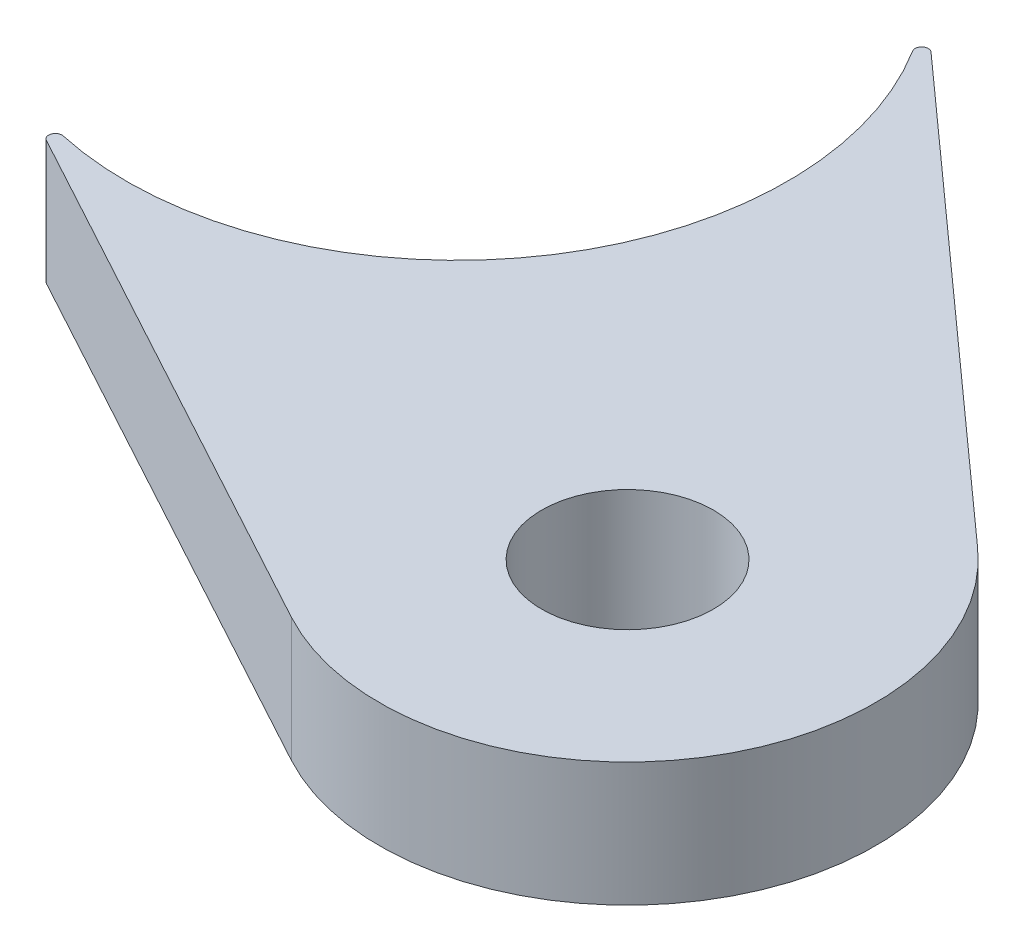
from build123d import *

# Parameters (mm, degrees)
SKETCH1_R           = 3.3
BOSS_EXTRUDE1_DEPTH = 4.7625
FILLET1_R           = 0.254


with BuildPart() as part:
    # Sketch1 → Boss-Extrude1 (new body)
    with BuildSketch(Plane(origin=(0, 0, 0), x_dir=(1, 0, 0), z_dir=(0, 1, 0))):
        with BuildLine():
            Line((17.670610129, -24.03336424), (-6.055469212, -11.163390731))
            ThreePointArc((-6.055469212, -11.163390731), (10.379538335, -7.318140744), (8.480594992, 9.453544763))
            Line((8.480594992, 9.453544763), (28.572658281, -8.570662619))
            ThreePointArc((28.572658281, -8.570662619), (29.996865789, -21.149426749), (17.670610129, -24.03336424))
        make_face()
        with Locations(Location((22.212212038, -15.660821191, 0), (0, 0, 90))):
            Circle(SKETCH1_R, mode=Mode.SUBTRACT)
    extrude(amount=BOSS_EXTRUDE1_DEPTH)

    # Fillet1
    fillet1_edges = [part.edges().sort_by_distance(p)[0] for p in [
        (-6.055469212, 2.38125, 11.163390731),
        (8.480594992, 2.38125, -9.453544763),
    ]]
    fillet(fillet1_edges, radius=FILLET1_R)


solid = part.part
